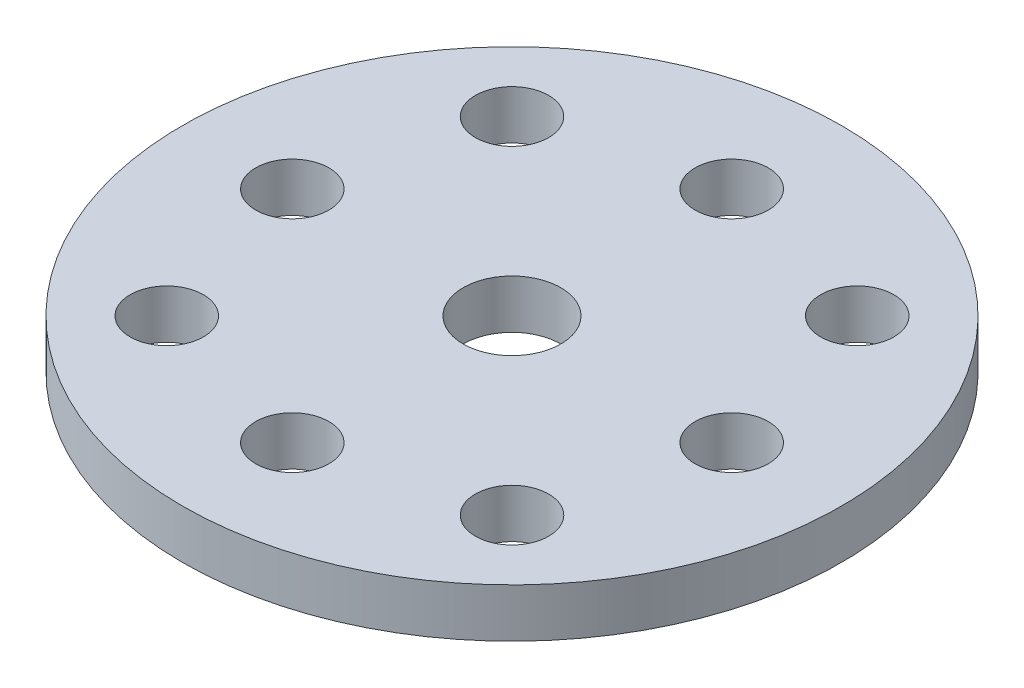
from build123d import *

# Parameters (mm, degrees)
SKETCH1_R           = 13.5
BOSS_EXTRUDE1_DEPTH = 2
SKETCH4_R           = 1.5
CUT_EXTRUDE1_DEPTH  = 20.19635382
CIRPATTERN1_COUNT   = 4
SKETCH2_R           = 2
CUT_EXTRUDE2_DEPTH  = 20.19635382


with BuildPart() as part:
    # Sketch1 → Boss-Extrude1 (new body)
    with BuildSketch(Plane(origin=(0, 0, 0), x_dir=(1, 0, 0), z_dir=(0, 1, 0))):
        with Locations(Location((0, 0, 0), (0, 0, 270))):
            Circle(SKETCH1_R)
    extrude(amount=BOSS_EXTRUDE1_DEPTH)

    # Sketch4 → Cut-Extrude1 (cut, through all)
    with BuildSketch(Plane.XZ):
        with Locations(Location((-9, 0, 0), (0, 0, 270))):
            Circle(SKETCH4_R)
        with Locations(Location((-7.071067812, -7.071067812, 0), (0, 0, 270))):
            Circle(SKETCH4_R)
    cut_extrude1 = extrude(amount=-CUT_EXTRUDE1_DEPTH, mode=Mode.SUBTRACT)

    # CirPattern1: Cut-Extrude1 ×4 about axis
    cirpattern1_axis = Axis((0, 0, 0), (0, 1, 0))
    for i in range(1, CIRPATTERN1_COUNT):
        add(cut_extrude1.rotate(cirpattern1_axis, i * 360 / CIRPATTERN1_COUNT), mode=Mode.SUBTRACT)

    # Sketch2 → Cut-Extrude2 (cut, through all)
    with BuildSketch(Plane(origin=(0, 2, 0), x_dir=(1, 0, 0), z_dir=(0, 1, 0))):
        with Locations(Location((0, 0, 0), (0, 0, 270))):
            Circle(SKETCH2_R)
    extrude(amount=-CUT_EXTRUDE2_DEPTH, mode=Mode.SUBTRACT)


solid = part.part
